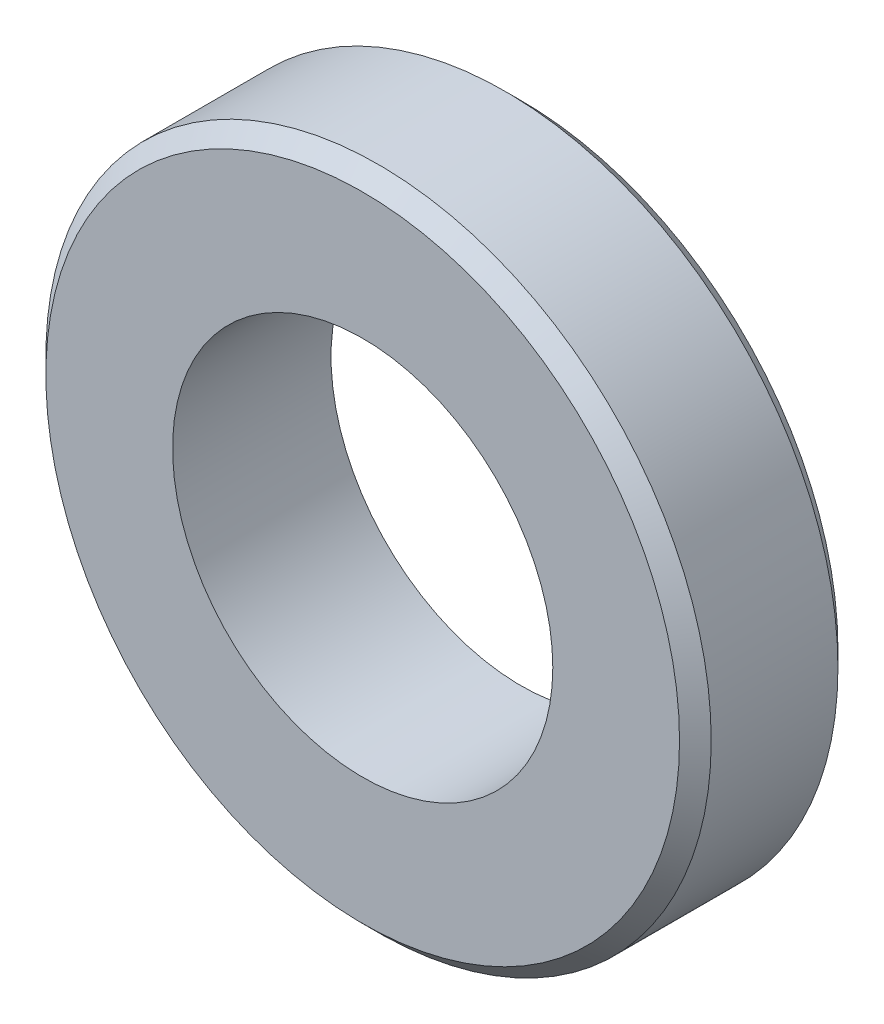
from build123d import *

# Parameters (mm, degrees)
SKETCH_1_R      = 10.5
SKETCH_1_R_2    = 6
EXTRUDE_1_DEPTH = 5
CHAMFER_1_SIZE  = 0.5


with BuildPart() as part:
    # 草图1 → 凸台-拉伸1 (new body)
    with BuildSketch(Plane.XY):
        Circle(SKETCH_1_R)
        Circle(SKETCH_1_R_2, mode=Mode.SUBTRACT)
    extrude(amount=EXTRUDE_1_DEPTH)

    # 倒角1
    chamfer_1_edges = [part.edges().sort_by_distance(p)[0] for p in [
        (-10.5, 0, 0),
        (-10.5, 0, 5),
    ]]
    chamfer(chamfer_1_edges, length=CHAMFER_1_SIZE)


solid = part.part
